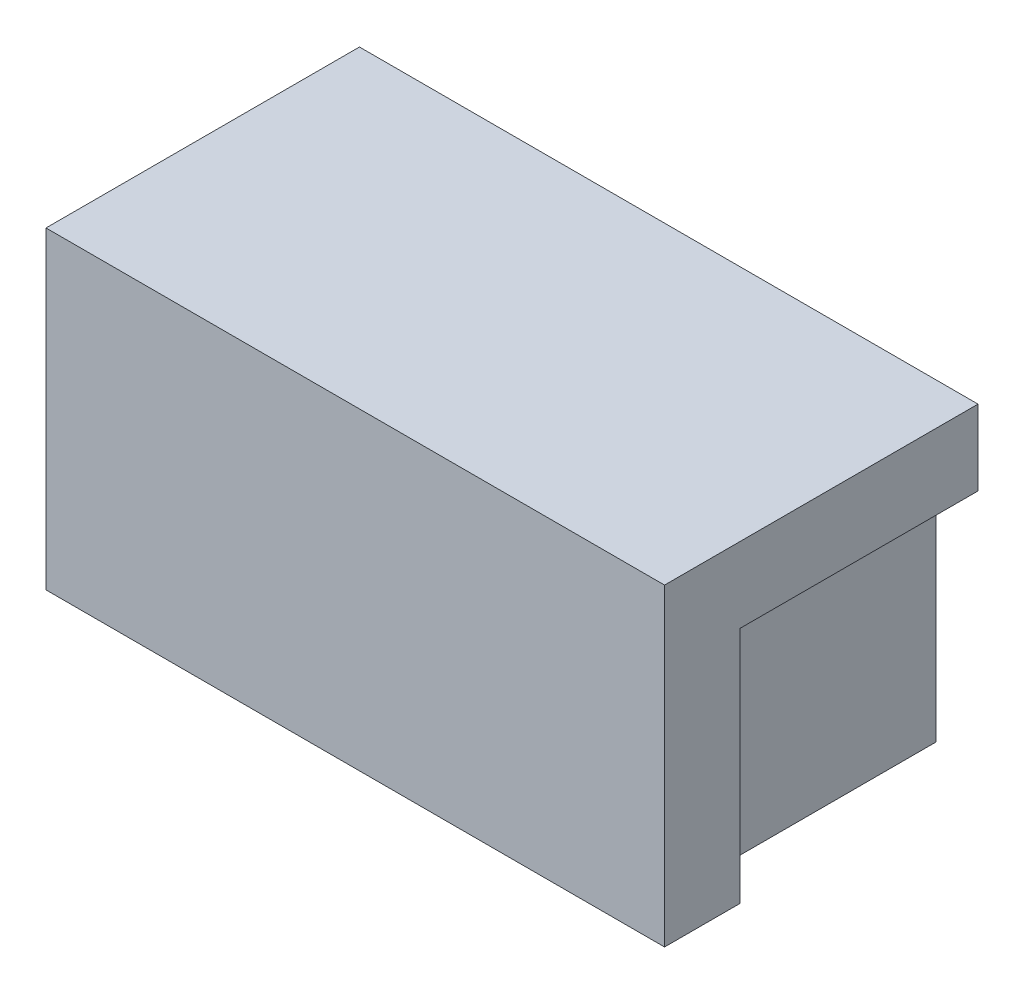
from build123d import *

# Parameters (mm, degrees)
SKETCH1_W           = 15
SKETCH1_H           = 15
SKETCH1_R           = 1.8
BOSS_EXTRUDE1_DEPTH = 3.6
BOSS_EXTRUDE2_DEPTH = 22
SKETCH2_W           = 15
SKETCH2_H           = 15
BOSS_EXTRUDE3_DEPTH = 2
BOSS_EXTRUDE4_DEPTH = 4


with BuildPart() as part:
    # Sketch1 → Boss-Extrude1 (new body)
    with BuildSketch(Plane(origin=(0, 0, 0), x_dir=(0, 0, -1), z_dir=(1, 0, 0))):
        Rectangle(SKETCH1_W, SKETCH1_H)
        Circle(SKETCH1_R, mode=Mode.SUBTRACT)
    extrude(amount=-BOSS_EXTRUDE1_DEPTH)

    # Sketch1<3> → Boss-Extrude2 (add)
    with BuildSketch(Plane(origin=(0, 0, 0), x_dir=(0, 0, -1), z_dir=(1, 0, 0))):
        Polygon((-7.5, -7.5), (-3.9, -7.5), (-3.9, 3.9), (3.9, 3.9), (3.9, -7.5), (7.5, -7.5), (7.5, 7.5), (-7.5, 7.5), align=None)
    extrude(amount=BOSS_EXTRUDE2_DEPTH)

    # Sketch2 → Boss-Extrude3 (add)
    with BuildSketch(Plane(origin=(22, 0, 0), x_dir=(0, 0, -1), z_dir=(1, 0, 0))):
        Rectangle(SKETCH2_W, SKETCH2_H)
    extrude(amount=BOSS_EXTRUDE3_DEPTH)

    # Sketch2<3> → Boss-Extrude4 (add)
    with BuildSketch(Plane(origin=(22, 0, 0), x_dir=(0, 0, -1), z_dir=(1, 0, 0))):
        Polygon((-7.5, 7.5), (-7.5, -7.5), (-3.9, -7.5), (-3.9, 3.9), (7.5, 3.9), (7.5, 7.5), align=None)
    extrude(amount=BOSS_EXTRUDE4_DEPTH)


solid = part.part
